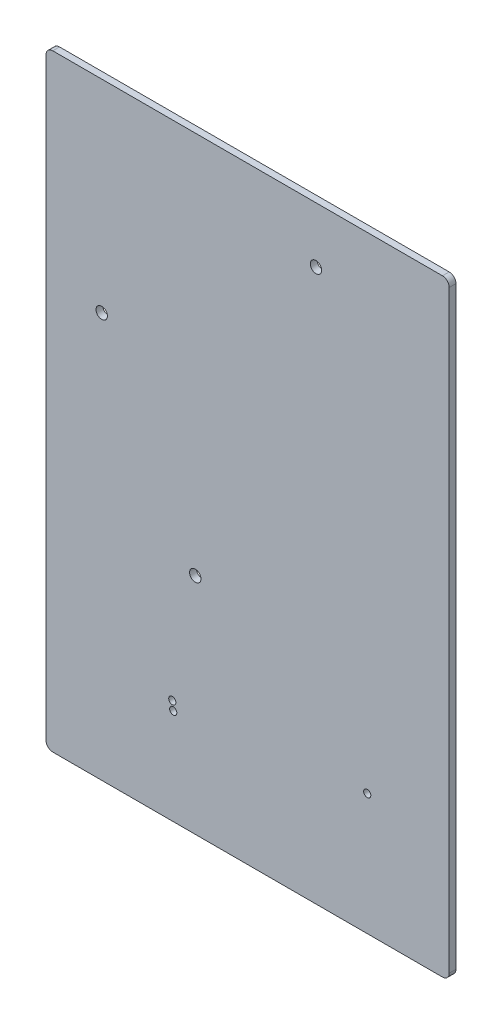
from build123d import *

# Parameters (mm, degrees)
BOSS_EXTRUDE1_DEPTH              = 6.35
FILLET1_R                        = 3.175
FILLET2_R                        = 44.45
F_1_4_CLEARANCE_HOLE1_D          = 6.7564
SKETCH4_W                        = 100.0125
SKETCH4_H                        = 155.575
CUT_EXTRUDE1_DEPTH               = 746.989881382
F_27_64_0_42188_DIAMETER_HOLE1_D = 10.715752
FILLET3_R                        = 6.35


with BuildPart() as part:
    # Sketch1 → Boss-Extrude1 (new body)
    with BuildSketch(Plane.XY):
        Polygon((0, 0), (0, 571.5), (379.4125, 571.5), (379.4125, 466.725), (479.425, 466.725), (479.425, 355.6), (428.625, 355.6), (428.625, 403.225), (379.4125, 403.225), (379.4125, 0), align=None)
    extrude(amount=BOSS_EXTRUDE1_DEPTH)

    # Fillet1
    fillet1_edges = [part.edges().sort_by_distance(p)[0] for p in [
        (428.625, 403.225, 3.175),
        (379.4125, 403.225, 3.175),
    ]]
    fillet(fillet1_edges, radius=FILLET1_R)

    # Fillet2
    fillet2_edges = [part.edges().sort_by_distance(p)[0] for p in [
        (379.4125, 466.725, 3.175),
        (479.425, 466.725, 3.175),
    ]]
    fillet(fillet2_edges, radius=FILLET2_R)

    # 1/4 Clearance Hole1 (through all)
    with Locations(Plane(origin=(0, 0, 0), x_dir=(-1, 0, 0), z_dir=(0, 0, -1))):
        with Locations((-118.810746346, 98.250269973), (-302.26, 114.3), (-119.685428778, 90.263601703)):
            Hole(F_1_4_CLEARANCE_HOLE1_D / 2)

    # Sketch4 → Cut-Extrude1 (cut, through all)
    with BuildSketch(Plane(origin=(0, 0, 0), x_dir=(-1, 0, 0), z_dir=(0, 0, -1))):
        with Locations((-429.41875, 433.3875)):
            Rectangle(SKETCH4_W, SKETCH4_H)
    extrude(amount=-CUT_EXTRUDE1_DEPTH, mode=Mode.SUBTRACT)

    # 27/64 (0.42188) Diameter Hole1 (through all)
    with Locations(Plane(origin=(0, 0, 0), x_dir=(-1, 0, 0), z_dir=(0, 0, -1))):
        with Locations((-254, 519.1125), (-52.3875, 381), (-140.462, 210.82)):
            Hole(F_27_64_0_42188_DIAMETER_HOLE1_D / 2)

    # Fillet3
    fillet3_edges = [part.edges().sort_by_distance(p)[0] for p in [
        (0, 0, 3.175),
        (0, 571.5, 3.175),
        (379.4125, 571.5, 3.175),
        (379.4125, 0, 3.175),
    ]]
    fillet(fillet3_edges, radius=FILLET3_R)


solid = part.part
